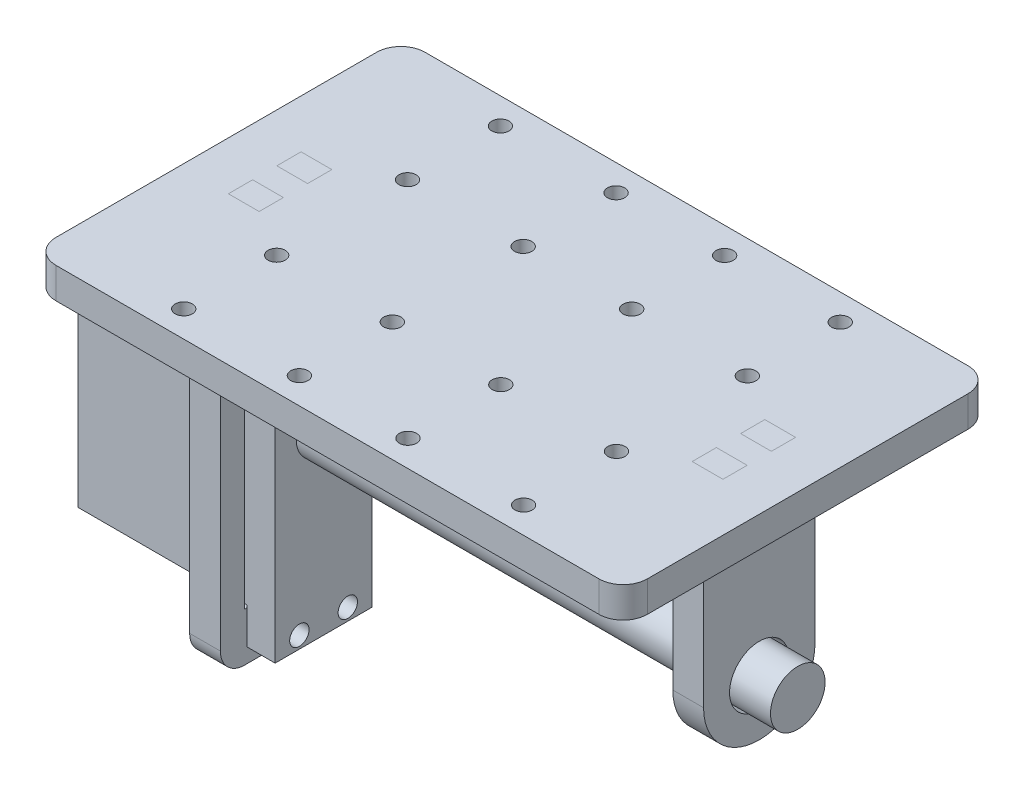
from build123d import *

# Parameters (mm, degrees)
BOSS_EXTRUDE2_DEPTH      = 3.7
BOSS_EXTRUDE2_DEPTH_BACK = 37
SKETCH1_W                = 20
SKETCH1_H                = 40
SKETCH1_3_R              = 5.64
BOSS_EXTRUDE3_DEPTH      = 101.6
SKETCH2_R                = 6.14
BOSS_EXTRUDE4_DEPTH      = 6.35
SKETCH3_R                = 2
SKETCH3_W                = 21
SKETCH3_H                = 41
BOSS_EXTRUDE5_DEPTH      = 6.35
BOSS_EXTRUDE8_DEPTH      = 3.7
BOSS_EXTRUDE8_DEPTH_BACK = 2.1
SKETCH1_4_W              = 20
SKETCH1_4_H              = 7.5
SKETCH1_4_R              = 2
SKETCH7_R                = 1.778
SKETCH7_W                = 6.35
SKETCH7_H                = 5
BOSS_EXTRUDE11_DEPTH     = 6.35


with BuildPart() as part:
    # Sketch1 → Boss-Extrude2 (new, two sides: drawn at the far end of the back side and taken through both)
    with BuildSketch(Plane(origin=(0, 0, 0), x_dir=(0, 0, -1), z_dir=(1, 0, 0)).offset(-BOSS_EXTRUDE2_DEPTH_BACK)):
        with Locations((10, 20)):
            Rectangle(SKETCH1_W, SKETCH1_H)
    extrude(amount=BOSS_EXTRUDE2_DEPTH + BOSS_EXTRUDE2_DEPTH_BACK)

    # Sketch1<3> → Boss-Extrude3 (add)
    with BuildSketch(Plane(origin=(0, 0, 0), x_dir=(0, 0, -1), z_dir=(1, 0, 0))):
        with Locations((10, 30.25)):
            Circle(SKETCH1_3_R)
    extrude(amount=BOSS_EXTRUDE3_DEPTH)

    # Sketch1<4> → Boss-Extrude8 (add, two sides: drawn at the far end of the back side and taken through both)
    # profile 1 of 2: a face of its own
    with BuildSketch(Plane(origin=(0, 0, 0), x_dir=(0, 0, -1), z_dir=(1, 0, 0)).offset(-BOSS_EXTRUDE8_DEPTH_BACK)):
        with Locations((10, 43.75)):
            Rectangle(SKETCH1_4_W, SKETCH1_4_H)
        with Locations((15, 45)):
            Circle(SKETCH1_4_R, mode=Mode.SUBTRACT)
        with Locations((5, 45)):
            Circle(SKETCH1_4_R, mode=Mode.SUBTRACT)
    # profile 2 of 2: a face of its own
    with BuildSketch(Plane(origin=(0, 0, 0), x_dir=(0, 0, -1), z_dir=(1, 0, 0)).offset(-BOSS_EXTRUDE8_DEPTH_BACK)):
        with Locations((10, -3.75)):
            Rectangle(SKETCH1_4_W, SKETCH1_4_H)
        with Locations((15, -5)):
            Circle(SKETCH1_4_R, mode=Mode.SUBTRACT)
        with Locations((5, -5)):
            Circle(SKETCH1_4_R, mode=Mode.SUBTRACT)
    extrude(amount=BOSS_EXTRUDE8_DEPTH + BOSS_EXTRUDE8_DEPTH_BACK)


with BuildPart() as body_2:
    # Sketch2 → Boss-Extrude4 (new body)
    with BuildSketch(Plane(origin=(87.3, 0, 0), x_dir=(0, 0, -1), z_dir=(1, 0, 0))):
        with BuildLine():
            ThreePointArc((-1.5, 30.25), (10, 18.75), (21.5, 30.25))
            Line((21.5, 30.25), (21.5, 40))
            Line((21.5, 40), (21.5, 62.75))
            Line((21.5, 62.75), (17.5, 62.75))
            Line((17.5, 62.75), (17.5, 69.1))
            Line((17.5, 69.1), (12.5, 69.1))
            Line((12.5, 69.1), (12.5, 62.75))
            Line((12.5, 62.75), (7.5, 62.75))
            Line((7.5, 62.75), (7.5, 69.1))
            Line((7.5, 69.1), (2.5, 69.1))
            Line((2.5, 69.1), (2.5, 62.75))
            Line((2.5, 62.75), (-1.5, 62.75))
            Line((-1.5, 62.75), (-1.5, 40))
            Line((-1.5, 40), (-1.5, 30.25))
        make_face()
        with Locations((10, 30.25)):
            Circle(SKETCH2_R, mode=Mode.SUBTRACT)
    extrude(amount=BOSS_EXTRUDE4_DEPTH)


with BuildPart() as body_3:
    # Sketch3 → Boss-Extrude5 (new body)
    with BuildSketch(Plane(origin=(-2.1, 0, 0), x_dir=(0, 0, -1), z_dir=(1, 0, 0))):
        with BuildLine():
            Line((-5.5, 62.75), (-5.5, -5.5))
            ThreePointArc((-5.5, -5.5), (-4.035533906, -9.035533906), (-0.5, -10.5))
            Line((-0.5, -10.5), (20.5, -10.5))
            ThreePointArc((20.5, -10.5), (24.035533906, -9.035533906), (25.5, -5.5))
            Line((25.5, -5.5), (25.5, 62.75))
            Line((25.5, 62.75), (17.5, 62.75))
            Line((17.5, 62.75), (17.5, 69.1))
            Line((17.5, 69.1), (12.5, 69.1))
            Line((12.5, 69.1), (12.5, 62.75))
            Line((12.5, 62.75), (7.5, 62.75))
            Line((7.5, 62.75), (7.5, 69.1))
            Line((7.5, 69.1), (2.5, 69.1))
            Line((2.5, 69.1), (2.5, 62.75))
            Line((2.5, 62.75), (-5.5, 62.75))
        make_face()
        with Locations((5, -5)):
            Circle(SKETCH3_R, mode=Mode.SUBTRACT)
        with Locations((5, 45)):
            Circle(SKETCH3_R, mode=Mode.SUBTRACT)
        with Locations((15, 45)):
            Circle(SKETCH3_R, mode=Mode.SUBTRACT)
        with Locations((15, -5)):
            Circle(SKETCH3_R, mode=Mode.SUBTRACT)
        with Locations((10, 20)):
            Rectangle(SKETCH3_W, SKETCH3_H, mode=Mode.SUBTRACT)
    extrude(amount=-BOSS_EXTRUDE5_DEPTH)


with BuildPart() as body_4:
    # Sketch7 → Boss-Extrude11 (new body)
    with BuildSketch(Plane(origin=(0, 62.75, 0), x_dir=(1, 0, 0), z_dir=(0, 1, 0))):
        with BuildLine():
            Line((98.65, 48.1), (-13.45, 48.1))
            ThreePointArc((-13.45, 48.1), (-16.985533906, 46.635533906), (-18.45, 43.1))
            Line((-18.45, 43.1), (-18.45, -23.1))
            ThreePointArc((-18.45, -23.1), (-16.985533906, -26.635533906), (-13.45, -28.1))
            Line((-13.45, -28.1), (98.65, -28.1))
            ThreePointArc((98.65, -28.1), (102.185533906, -26.635533906), (103.65, -23.1))
            Line((103.65, -23.1), (103.65, 43.1))
            ThreePointArc((103.65, 43.1), (102.185533906, 46.635533906), (98.65, 48.1))
        make_face()
        with Locations((7.522, -22.691)):
            Circle(SKETCH7_R, mode=Mode.SUBTRACT)
        with Locations((31.398, -22.691)):
            Circle(SKETCH7_R, mode=Mode.SUBTRACT)
        with Locations((7.522, -3.509)):
            Circle(SKETCH7_R, mode=Mode.SUBTRACT)
        with Locations((-5.275, 15)):
            Rectangle(SKETCH7_W, SKETCH7_H, mode=Mode.SUBTRACT)
        with Locations((-5.275, 5)):
            Rectangle(SKETCH7_W, SKETCH7_H, mode=Mode.SUBTRACT)
        with Locations((31.398, -3.509)):
            Circle(SKETCH7_R, mode=Mode.SUBTRACT)
        with Locations((53.802, -22.691)):
            Circle(SKETCH7_R, mode=Mode.SUBTRACT)
        with Locations((77.678, -22.691)):
            Circle(SKETCH7_R, mode=Mode.SUBTRACT)
        with Locations((53.802, -3.509)):
            Circle(SKETCH7_R, mode=Mode.SUBTRACT)
        with Locations((77.678, -3.509)):
            Circle(SKETCH7_R, mode=Mode.SUBTRACT)
        with Locations((90.475, 5)):
            Rectangle(SKETCH7_W, SKETCH7_H, mode=Mode.SUBTRACT)
        with Locations((7.522, 23.509)):
            Circle(SKETCH7_R, mode=Mode.SUBTRACT)
        with Locations((31.398, 23.509)):
            Circle(SKETCH7_R, mode=Mode.SUBTRACT)
        with Locations((7.522, 42.691)):
            Circle(SKETCH7_R, mode=Mode.SUBTRACT)
        with Locations((31.398, 42.691)):
            Circle(SKETCH7_R, mode=Mode.SUBTRACT)
        with Locations((53.802, 23.509)):
            Circle(SKETCH7_R, mode=Mode.SUBTRACT)
        with Locations((90.475, 15)):
            Rectangle(SKETCH7_W, SKETCH7_H, mode=Mode.SUBTRACT)
        with Locations((77.678, 23.509)):
            Circle(SKETCH7_R, mode=Mode.SUBTRACT)
        with Locations((53.802, 42.691)):
            Circle(SKETCH7_R, mode=Mode.SUBTRACT)
        with Locations((77.678, 42.691)):
            Circle(SKETCH7_R, mode=Mode.SUBTRACT)
    extrude(amount=BOSS_EXTRUDE11_DEPTH)


solid = Compound([part.part, body_2.part, body_3.part, body_4.part])
